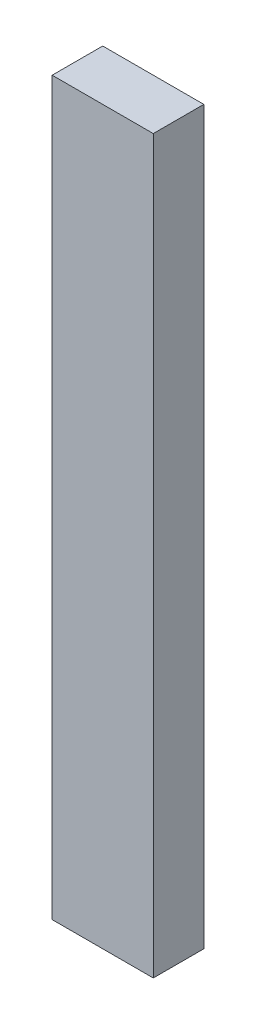
from build123d import *

# Parameters (mm, degrees)
SKETCH1_W           = 30
SKETCH1_H           = 15
BOSS_EXTRUDE1_DEPTH = 217


with BuildPart() as part:
    # Sketch1 → Boss-Extrude1 (new body)
    with BuildSketch(Plane(origin=(0, 0, 0), x_dir=(1, 0, 0), z_dir=(0, 1, 0))):
        with Locations((-25.168831169, -0.623376623)):
            Rectangle(SKETCH1_W, SKETCH1_H)
    extrude(amount=BOSS_EXTRUDE1_DEPTH)


solid = part.part
